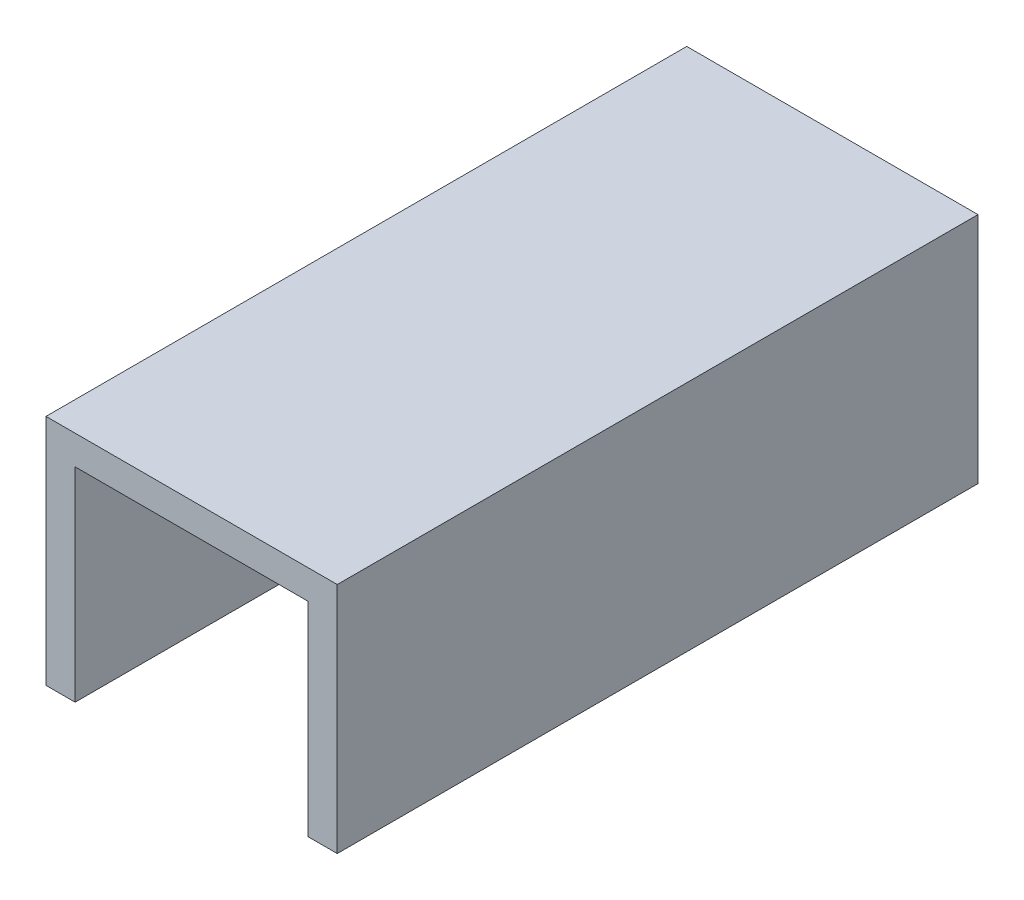
from build123d import *

# Parameters (mm, degrees)
SKETCH1_W           = 50
SKETCH1_H           = 40
BOSS_EXTRUDE1_DEPTH = 110
SKETCH2_W           = 40
SKETCH2_H           = 35
CUT_EXTRUDE1_DEPTH  = 105


with BuildPart() as part:
    # Sketch1 → Boss-Extrude1 (new body)
    with BuildSketch(Plane.XY):
        Rectangle(SKETCH1_W, SKETCH1_H)
    extrude(amount=BOSS_EXTRUDE1_DEPTH)

    # Sketch2 → Cut-Extrude1 (cut)
    with BuildSketch(Plane.XY.offset(110)):
        with Locations((0, -2.5)):
            Rectangle(SKETCH2_W, SKETCH2_H)
    extrude(amount=-CUT_EXTRUDE1_DEPTH, mode=Mode.SUBTRACT)


solid = part.part
